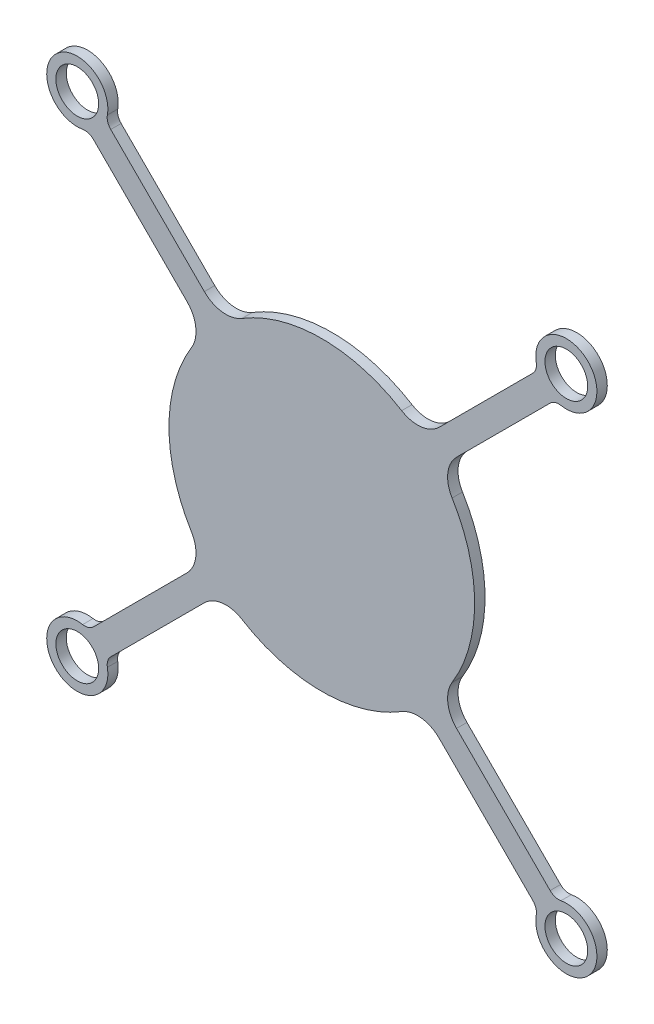
from build123d import *

# Parameters (mm, degrees)
SKETCH1_R           = 3.5
BOSS_EXTRUDE2_DEPTH = 1.7
FILLET1_R           = 5
FILLET2_R           = 2


with BuildPart() as part:
    # Sketch1 → Boss-Extrude2 (new body)
    with BuildSketch(Plane.XY):
        with BuildLine():
            Line((35.345416088, -38.173843213), (16.206796624, -19.035223749))
            ThreePointArc((16.206796624, -19.035223749), (0, -25), (-16.206796624, -19.035223749))
            Line((-16.206796624, -19.035223749), (-35.345416088, -38.173843213))
            ThreePointArc((-35.345416088, -38.173843213), (-43.535533906, -43.535533906), (-38.173843213, -35.345416088))
            Line((-38.173843213, -35.345416088), (-19.035223749, -16.206796624))
            ThreePointArc((-19.035223749, -16.206796624), (-25, 0), (-19.035223749, 16.206796624))
            Line((-19.035223749, 16.206796624), (-38.173843213, 35.345416088))
            ThreePointArc((-38.173843213, 35.345416088), (-43.535533906, 43.535533906), (-35.345416088, 38.173843213))
            Line((-35.345416088, 38.173843213), (-16.206796624, 19.035223749))
            ThreePointArc((-16.206796624, 19.035223749), (0, 25), (16.206796624, 19.035223749))
            Line((16.206796624, 19.035223749), (35.345416088, 38.173843213))
            ThreePointArc((35.345416088, 38.173843213), (43.535533906, 43.535533906), (38.173843213, 35.345416088))
            Line((38.173843213, 35.345416088), (19.035223749, 16.206796624))
            ThreePointArc((19.035223749, 16.206796624), (25, 0), (19.035223749, -16.206796624))
            Line((19.035223749, -16.206796624), (38.173843213, -35.345416088))
            ThreePointArc((38.173843213, -35.345416088), (43.535533906, -43.535533906), (35.345416088, -38.173843213))
        make_face()
        with Locations((-40, 40)):
            Circle(SKETCH1_R, mode=Mode.SUBTRACT)
        with Locations((40, 40)):
            Circle(SKETCH1_R, mode=Mode.SUBTRACT)
        with Locations((40, -40)):
            Circle(SKETCH1_R, mode=Mode.SUBTRACT)
        with Locations((-40, -40)):
            Circle(SKETCH1_R, mode=Mode.SUBTRACT)
    extrude(amount=BOSS_EXTRUDE2_DEPTH)

    # Fillet1
    fillet1_edges = [part.edges().sort_by_distance(p)[0] for p in [
        (16.206796624, 19.035223749, 0.85),
        (19.035223749, 16.206796624, 0.85),
        (19.035223749, -16.206796624, 0.85),
        (16.206796624, -19.035223749, 0.85),
        (-16.206796624, -19.035223749, 0.85),
        (-19.035223749, -16.206796624, 0.85),
        (-19.035223749, 16.206796624, 0.85),
        (-16.206796624, 19.035223749, 0.85),
    ]]
    fillet(fillet1_edges, radius=FILLET1_R)

    # Fillet2
    fillet2_edges = [part.edges().sort_by_distance(p)[0] for p in [
        (35.345416088, 38.173843213, 0.85),
        (38.173843213, 35.345416088, 0.85),
        (38.173843213, -35.345416088, 0.85),
        (35.345416088, -38.173843213, 0.85),
        (-35.345416088, -38.173843213, 0.85),
        (-38.173843213, -35.345416088, 0.85),
        (-38.173843213, 35.345416088, 0.85),
        (-35.345416088, 38.173843213, 0.85),
    ]]
    fillet(fillet2_edges, radius=FILLET2_R)


solid = part.part
